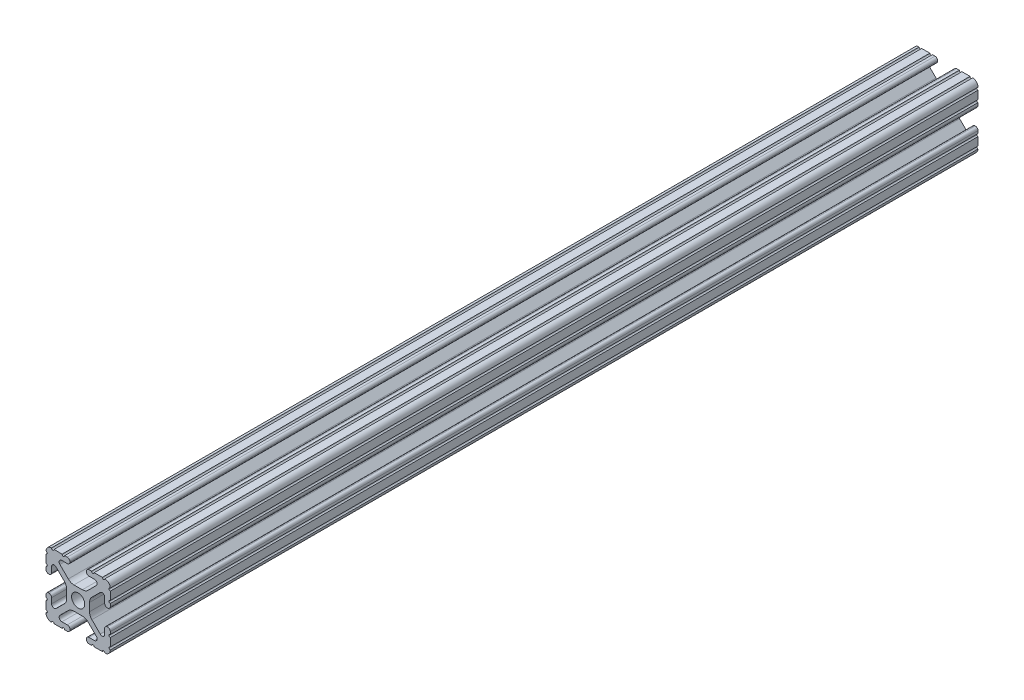
from build123d import *

# Parameters (mm, degrees)
SKETCH1_R           = 2.6035
BOSS_EXTRUDE1_DEPTH = 171.45


with BuildPart() as part:
    # Sketch1 → Boss-Extrude1 (new, symmetric)
    with BuildSketch(Plane.XY):
        with BuildLine():
            Line((-7.179650497, -8.645192506), (-3.952270251, -5.423690499))
            ThreePointArc((-3.952270251, -5.423690499), (-2.922936451, -4.736929036), (-1.709253557, -4.4958))
            Line((-1.709253557, -4.4958), (1.709253557, -4.4958))
            ThreePointArc((1.709253557, -4.4958), (2.922936451, -4.736929036), (3.952270251, -5.423690499))
            Line((3.952270251, -5.423690499), (7.179650497, -8.645192506))
            ThreePointArc((7.179650497, -8.645192506), (7.41473083, -9.822813117), (6.416408329, -10.4902))
            Line((6.416408329, -10.4902), (4.287512407, -10.4902))
            ThreePointArc((4.287512407, -10.4902), (3.54574862, -10.79744862), (3.2385, -11.539212407))
            Line((3.2385, -11.539212407), (3.2385, -11.650987593))
            ThreePointArc((3.2385, -11.650987593), (3.54574862, -12.39275138), (4.287512407, -12.7))
            Line((4.287512407, -12.7), (5.317126718, -12.7))
            ThreePointArc((5.317126718, -12.7), (5.825126718, -12.192), (6.333126718, -12.7))
            Line((6.333126718, -12.7), (9.550443118, -12.7))
            ThreePointArc((9.550443118, -12.7), (10.058366869, -12.192000006), (10.566443095, -12.699847501))
            ThreePointArc((10.566443095, -12.699847501), (12.082537762, -12.08250727), (12.699846982, -10.566399977))
            ThreePointArc((12.699846982, -10.566399977), (12.192000006, -10.058323491), (12.7, -9.5504))
            Line((12.7, -9.5504), (12.7, -6.3330836))
            ThreePointArc((12.7, -6.3330836), (12.192, -5.8250836), (12.7, -5.3170836))
            Line((12.7, -5.3170836), (12.7, -4.287469289))
            ThreePointArc((12.7, -4.287469289), (12.39275138, -3.545705502), (11.650987593, -3.238456882))
            Line((11.650987593, -3.238456882), (11.539212407, -3.238456882))
            ThreePointArc((11.539212407, -3.238456882), (10.79744862, -3.545705502), (10.4902, -4.287469289))
            Line((10.4902, -4.287469289), (10.4902, -6.402089023))
            ThreePointArc((10.4902, -6.402089023), (9.856505071, -7.351067942), (8.737131347, -7.129408934))
            Line((8.737131347, -7.129408934), (5.441005833, -3.840816462))
            ThreePointArc((5.441005833, -3.840816462), (4.750877967, -2.809883091), (4.5085, -1.593185507))
            Line((4.5085, -1.593185507), (4.5085, 1.593185507))
            ThreePointArc((4.5085, 1.593185507), (4.750877967, 2.809883091), (5.441005833, 3.840816462))
            Line((5.441005833, 3.840816462), (8.737131347, 7.129408934))
            ThreePointArc((8.737131347, 7.129408934), (9.856505071, 7.351067942), (10.4902, 6.402089023))
            Line((10.4902, 6.402089023), (10.4902, 4.287469289))
            ThreePointArc((10.4902, 4.287469289), (10.79744862, 3.545705502), (11.539212407, 3.238456882))
            Line((11.539212407, 3.238456882), (11.650987593, 3.238456882))
            ThreePointArc((11.650987593, 3.238456882), (12.39275138, 3.545705502), (12.7, 4.287469289))
            Line((12.7, 4.287469289), (12.7, 5.3170836))
            ThreePointArc((12.7, 5.3170836), (12.192, 5.8250836), (12.7, 6.3330836))
            Line((12.7, 6.3330836), (12.7, 9.5504))
            ThreePointArc((12.7, 9.5504), (12.192000006, 10.058323491), (12.699846982, 10.566399977))
            ThreePointArc((12.699846982, 10.566399977), (12.082537762, 12.08250727), (10.566443095, 12.699847501))
            ThreePointArc((10.566443095, 12.699847501), (10.058366869, 12.192000006), (9.550443118, 12.7))
            Line((9.550443118, 12.7), (6.333126718, 12.7))
            ThreePointArc((6.333126718, 12.7), (5.825126718, 12.192), (5.317126718, 12.7))
            Line((5.317126718, 12.7), (4.287512407, 12.7))
            ThreePointArc((4.287512407, 12.7), (3.54574862, 12.39275138), (3.2385, 11.650987593))
            Line((3.2385, 11.650987593), (3.2385, 11.539212407))
            ThreePointArc((3.2385, 11.539212407), (3.54574862, 10.79744862), (4.287512407, 10.4902))
            Line((4.287512407, 10.4902), (6.476788598, 10.4902))
            ThreePointArc((6.476788598, 10.4902), (7.432222385, 9.85140422), (7.207036008, 8.724370562))
            Line((7.207036008, 8.724370562), (3.898272566, 5.423169045))
            ThreePointArc((3.898272566, 5.423169045), (2.869120213, 4.736787962), (1.655778399, 4.4958))
            Line((1.655778399, 4.4958), (-1.655778399, 4.4958))
            ThreePointArc((-1.655778399, 4.4958), (-2.869120213, 4.736787962), (-3.898272566, 5.423169045))
            Line((-3.898272566, 5.423169045), (-7.207036008, 8.724370562))
            ThreePointArc((-7.207036008, 8.724370562), (-7.432222385, 9.85140422), (-6.476788598, 10.4902))
            Line((-6.476788598, 10.4902), (-4.287512407, 10.4902))
            ThreePointArc((-4.287512407, 10.4902), (-3.54574862, 10.79744862), (-3.2385, 11.539212407))
            Line((-3.2385, 11.539212407), (-3.2385, 11.650987593))
            ThreePointArc((-3.2385, 11.650987593), (-3.54574862, 12.39275138), (-4.287512407, 12.7))
            Line((-4.287512407, 12.7), (-5.317126718, 12.7))
            ThreePointArc((-5.317126718, 12.7), (-5.825126718, 12.192), (-6.333126718, 12.7))
            Line((-6.333126718, 12.7), (-9.550443118, 12.7))
            ThreePointArc((-9.550443118, 12.7), (-10.058366869, 12.192000006), (-10.566443095, 12.699847501))
            ThreePointArc((-10.566443095, 12.699847501), (-12.082537762, 12.08250727), (-12.699846982, 10.566399977))
            ThreePointArc((-12.699846982, 10.566399977), (-12.192000006, 10.058323491), (-12.7, 9.5504))
            Line((-12.7, 9.5504), (-12.7, 6.3330836))
            ThreePointArc((-12.7, 6.3330836), (-12.192, 5.8250836), (-12.7, 5.3170836))
            Line((-12.7, 5.3170836), (-12.7, 4.287469289))
            ThreePointArc((-12.7, 4.287469289), (-12.39275138, 3.545705502), (-11.650987593, 3.238456882))
            Line((-11.650987593, 3.238456882), (-11.539212407, 3.238456882))
            ThreePointArc((-11.539212407, 3.238456882), (-10.79744862, 3.545705502), (-10.4902, 4.287469289))
            Line((-10.4902, 4.287469289), (-10.4902, 6.402089023))
            ThreePointArc((-10.4902, 6.402089023), (-9.856505071, 7.351067942), (-8.737131347, 7.129408934))
            Line((-8.737131347, 7.129408934), (-5.441005833, 3.840816462))
            ThreePointArc((-5.441005833, 3.840816462), (-4.750877967, 2.809883091), (-4.5085, 1.593185507))
            Line((-4.5085, 1.593185507), (-4.5085, -1.593185507))
            ThreePointArc((-4.5085, -1.593185507), (-4.750877967, -2.809883091), (-5.441005833, -3.840816462))
            Line((-5.441005833, -3.840816462), (-8.737131347, -7.129408934))
            ThreePointArc((-8.737131347, -7.129408934), (-9.856505071, -7.351067942), (-10.4902, -6.402089023))
            Line((-10.4902, -6.402089023), (-10.4902, -4.287469289))
            ThreePointArc((-10.4902, -4.287469289), (-10.79744862, -3.545705502), (-11.539212407, -3.238456882))
            Line((-11.539212407, -3.238456882), (-11.650987593, -3.238456882))
            ThreePointArc((-11.650987593, -3.238456882), (-12.39275138, -3.545705502), (-12.7, -4.287469289))
            Line((-12.7, -4.287469289), (-12.7, -5.3170836))
            ThreePointArc((-12.7, -5.3170836), (-12.192, -5.8250836), (-12.7, -6.3330836))
            Line((-12.7, -6.3330836), (-12.7, -9.5504))
            ThreePointArc((-12.7, -9.5504), (-12.192000006, -10.058323491), (-12.699846982, -10.566399977))
            ThreePointArc((-12.699846982, -10.566399977), (-12.082537762, -12.08250727), (-10.566443095, -12.699847501))
            ThreePointArc((-10.566443095, -12.699847501), (-10.058366869, -12.192000006), (-9.550443118, -12.7))
            Line((-9.550443118, -12.7), (-6.333126718, -12.7))
            ThreePointArc((-6.333126718, -12.7), (-5.825126718, -12.192), (-5.317126718, -12.7))
            Line((-5.317126718, -12.7), (-4.287512407, -12.7))
            ThreePointArc((-4.287512407, -12.7), (-3.54574862, -12.39275138), (-3.2385, -11.650987593))
            Line((-3.2385, -11.650987593), (-3.2385, -11.539212407))
            ThreePointArc((-3.2385, -11.539212407), (-3.54574862, -10.79744862), (-4.287512407, -10.4902))
            Line((-4.287512407, -10.4902), (-6.416408329, -10.4902))
            ThreePointArc((-6.416408329, -10.4902), (-7.41473083, -9.822813117), (-7.179650497, -8.645192506))
        make_face()
        Circle(SKETCH1_R, mode=Mode.SUBTRACT)
    extrude(amount=BOSS_EXTRUDE1_DEPTH, both=True)


solid = part.part
